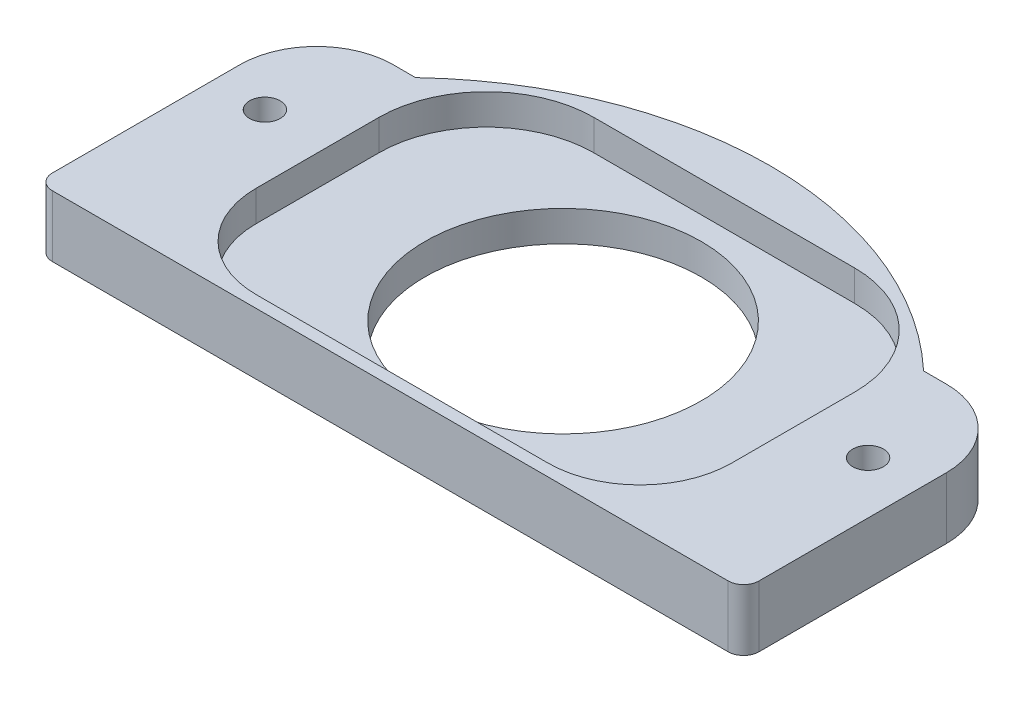
from build123d import *

# Parameters (mm, degrees)
BOSS_EXTRUDE1_DEPTH       = 4
F_2_0MM_DOWEL_HOLE1_D     = 18
F_2_0MM_DOWEL_HOLE2_D     = 2
F_2_0MM_DOWEL_HOLE2_DEPTH = 10
CUT_EXTRUDE3_DEPTH        = 2


with BuildPart() as part:
    # Sketch1 → Boss-Extrude1 (new body)
    with BuildSketch(Plane(origin=(0, 0, 0), x_dir=(1, 0, 0), z_dir=(0, 1, 0))):
        with BuildLine():
            Line((16.549446177, 5.7), (18.037708346, 5.7))
            ThreePointArc((18.037708346, 5.7), (21.573242252, 4.235533906), (23.037708346, 0.7))
            Line((23.037708346, 0.7), (23.037708346, -11.514786255))
            ThreePointArc((23.037708346, -11.514786255), (22.744815127, -12.221893036), (22.037708346, -12.514786255))
            Line((22.037708346, -12.514786255), (-22, -12.514786255))
            ThreePointArc((-22, -12.514786255), (-22.707106781, -12.221893036), (-23, -11.514786255))
            Line((-23, -11.514786255), (-23, 0.7))
            ThreePointArc((-23, 0.7), (-21.535533906, 4.235533906), (-18, 5.7))
            Line((-18, 5.7), (-16.549446177, 5.7))
            ThreePointArc((-16.549446177, 5.7), (0, 12.280701177), (16.549446177, 5.7))
        make_face()
    extrude(amount=BOSS_EXTRUDE1_DEPTH)

    # Ø2.0mm Dowel Hole1 (through all)
    with Locations(Plane(origin=(0, 4, 0), x_dir=(1, 0, 0), z_dir=(0, 1, 0))):
        with Locations((0, -1.235213745)):
            Hole(F_2_0MM_DOWEL_HOLE1_D / 2)

    # Ø2.0mm Dowel Hole2
    with Locations(Plane(origin=(0, 4, 0), x_dir=(1, 0, 0), z_dir=(0, 1, 0))):
        with Locations((-19.65, -1.014786255), (19.65, -1.014786255)):
            Hole(F_2_0MM_DOWEL_HOLE2_D / 2, depth=F_2_0MM_DOWEL_HOLE2_DEPTH)

    # Sketch9 → Cut-Extrude3 (cut)
    with BuildSketch(Plane(origin=(0, 4, 0), x_dir=(1, 0, 0), z_dir=(0, 1, 0))):
        with BuildLine():
            Line((-8.5, 9.264786255), (8.5, 9.264786255))
            ThreePointArc((8.5, 9.264786255), (13.449747468, 7.214533723), (15.5, 2.264786255))
            Line((15.5, 2.264786255), (15.5, -5.735213745))
            ThreePointArc((15.5, -5.735213745), (13.742640687, -9.977854433), (9.5, -11.735213745))
            Line((9.5, -11.735213745), (-9.5, -11.735213745))
            ThreePointArc((-9.5, -11.735213745), (-13.742640687, -9.977854433), (-15.5, -5.735213745))
            Line((-15.5, -5.735213745), (-15.5, 2.264786255))
            ThreePointArc((-15.5, 2.264786255), (-13.449747468, 7.214533723), (-8.5, 9.264786255))
        make_face()
    extrude(amount=-CUT_EXTRUDE3_DEPTH, mode=Mode.SUBTRACT)


solid = part.part
